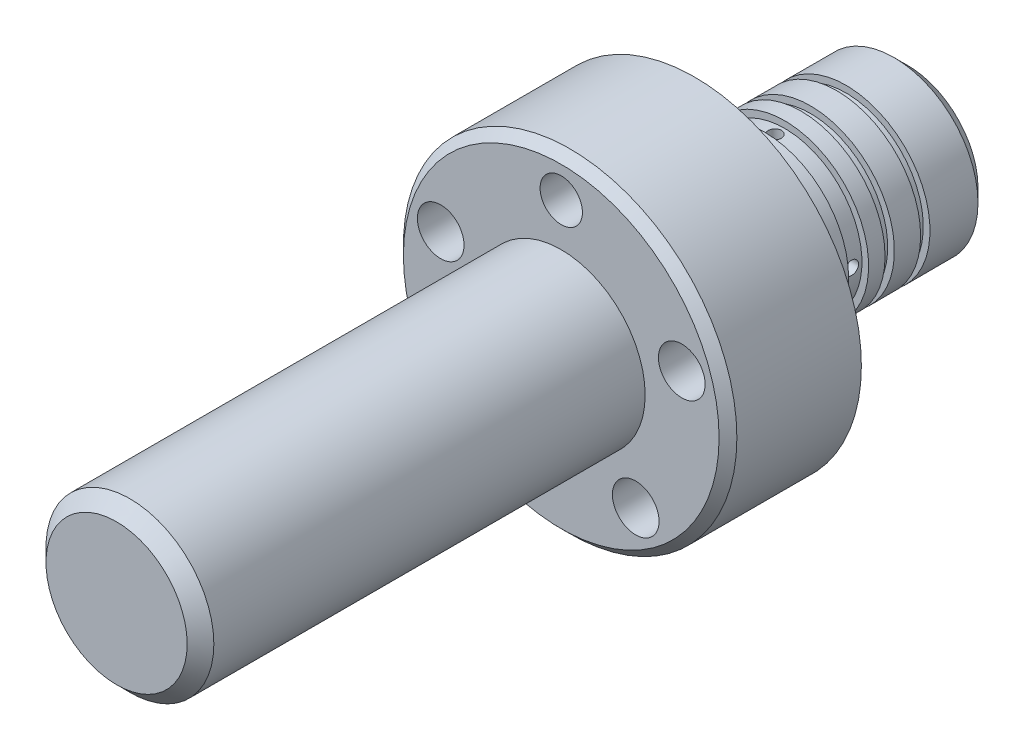
from build123d import *

# Parameters (mm, degrees)
SKETCH1_R                 = 18.875
BOSS_EXTRUDE1_DEPTH       = 47.85
SKETCH2_R                 = 37.5
BOSS_EXTRUDE2_DEPTH       = 30
SKETCH11_R                = 3.125
CUT_EXTRUDE4_DEPTH        = 30
SKETCH12_R                = 4.7625
CUT_EXTRUDE5_DEPTH        = 8
SKETCH13_W                = 2.1
SKETCH13_H                = 3
SKETCH13_W_2              = 4.5
SKETCH13_H_2              = 2.2
SKETCH18_R                = 3.125
CUT_EXTRUDE8_DEPTH        = 30
SKETCH19_R                = 5.25
CUT_EXTRUDE9_DEPTH        = 27
CHAMFER1_SIZE             = 2
SKETCH20_R                = 18.875
BOSS_EXTRUDE3_DEPTH       = 100
F_8_0MM_DOWEL_HOLE1_D     = 8
F_8_0MM_DOWEL_HOLE1_DEPTH = 77.85
F_8_0MM_DOWEL_HOLE1_TIP   = 2.403442476
CHAMFER2_SIZE             = 3
SKETCH26_R                = 1.5
CUT_EXTRUDE10_DEPTH       = 186.58858401
CIRPATTERN1_COUNT         = 4


with BuildPart() as part:
    # Sketch1 → Boss-Extrude1 (new body)
    with BuildSketch(Plane.XY):
        Circle(SKETCH1_R)
    extrude(amount=BOSS_EXTRUDE1_DEPTH)

    # Sketch2 → Boss-Extrude2 (add)
    with BuildSketch(Plane.XY.offset(47.85)):
        Circle(SKETCH2_R)
    extrude(amount=BOSS_EXTRUDE2_DEPTH)

    # Sketch11 → Cut-Extrude4 (cut)
    with BuildSketch(Plane.XY.offset(77.85)):
        with Locations((0, 28.5)):
            Circle(SKETCH11_R)
    extrude(amount=-CUT_EXTRUDE4_DEPTH, mode=Mode.SUBTRACT)

    # Sketch12 → Cut-Extrude5 (cut)
    with BuildSketch(Plane.XY.offset(77.85)):
        with Locations((0, 28.5)):
            Circle(SKETCH12_R)
    extrude(amount=-CUT_EXTRUDE5_DEPTH, mode=Mode.SUBTRACT)

    # Sketch13 → Cut-Revolve1 (revolve, cut)
    with BuildSketch(Plane(origin=(0, 0, 0), x_dir=(0, 0, -1), z_dir=(1, 0, 0)), mode=Mode.PRIVATE) as cut_revolve1_sk:
        with Locations((-14.85, 18.875)):
            Rectangle(SKETCH13_W, SKETCH13_H)
        with Locations((-22.85, 18.875)):
            Rectangle(SKETCH13_W, SKETCH13_H)
        with Locations((-35.85, 18.875)):
            Rectangle(SKETCH13_W, SKETCH13_H)
        with Locations((-39.85, 18.875)):
            Rectangle(SKETCH13_W, SKETCH13_H)
        with Locations((-29.85, 18.475)):
            Rectangle(SKETCH13_W_2, SKETCH13_H_2)
    revolve(cut_revolve1_sk.sketch.rotate(Axis((0, 0, 0), (0, 0, 1)), 90), axis=Axis((0, 0, 0), (0, 0, 1)), mode=Mode.SUBTRACT)

    # Sketch18 → Cut-Extrude8 (cut)
    with BuildSketch(Plane.XY.offset(77.85)):
        with Locations((27.105110714, 8.80698434)):
            Circle(SKETCH18_R)
        with Locations((16.75187969, -23.05698434)):
            Circle(SKETCH18_R)
        with Locations((-16.75187969, -23.05698434)):
            Circle(SKETCH18_R)
        with Locations((-27.105110714, 8.80698434)):
            Circle(SKETCH18_R)
    extrude(amount=-CUT_EXTRUDE8_DEPTH, mode=Mode.SUBTRACT)

    # Sketch19 → Cut-Extrude9 (cut)
    with BuildSketch(Plane.XY.offset(77.85)):
        with Locations((27.105110714, 8.80698434)):
            Circle(SKETCH19_R)
        with Locations((16.75187969, -23.05698434)):
            Circle(SKETCH19_R)
        with Locations((-16.75187969, -23.05698434)):
            Circle(SKETCH19_R)
        with Locations((-27.105110714, 8.80698434)):
            Circle(SKETCH19_R)
    extrude(amount=-CUT_EXTRUDE9_DEPTH, mode=Mode.SUBTRACT)

    # Chamfer1
    chamfer1_edges = [part.edges().sort_by_distance(p)[0] for p in [
        (-37.5, 0, 77.85),
    ]]
    chamfer(chamfer1_edges, length=CHAMFER1_SIZE)

    # Sketch20 → Boss-Extrude3 (add)
    with BuildSketch(Plane.XY.offset(77.85)):
        with Locations(Location((0, 0, 0), (0, 0, 180))):
            Circle(SKETCH20_R)
    extrude(amount=BOSS_EXTRUDE3_DEPTH)

    # Ø8.0mm Dowel Hole1
    with Locations(Plane(origin=(0, 0, 0), x_dir=(-1, 0, 0), z_dir=(0, 0, -1))):
        with Locations((0, 0)):
            Hole(F_8_0MM_DOWEL_HOLE1_D / 2, depth=F_8_0MM_DOWEL_HOLE1_DEPTH)
            with Locations((0, 0, -(F_8_0MM_DOWEL_HOLE1_DEPTH + F_8_0MM_DOWEL_HOLE1_TIP / 2))):  # 118° drill point
                Cone(0, F_8_0MM_DOWEL_HOLE1_D / 2, F_8_0MM_DOWEL_HOLE1_TIP, mode=Mode.SUBTRACT)

    # Sketch25 → Cut-Revolve2 (revolve, cut)
    with BuildSketch(Plane(origin=(0, 0, 0), x_dir=(0, 0, -1), z_dir=(1, 0, 0))):
        Polygon((-65.25, 0), (-65.25, -12.5), (-65.85, -12.5), (-65.85, -22.5), (-71.85, -22.5), (-71.85, -41.115481675), (-61.85, -41.115481675), (-61.85, 0), align=None)
    revolve(axis=Axis((0, 37.5, 61.85), (0, -1, 0)), mode=Mode.SUBTRACT)

    # Chamfer2
    chamfer2_edges = [part.edges().sort_by_distance(p)[0] for p in [
        (18.875, 0, 177.85),
        (-18.875, 0, 0),
    ]]
    chamfer(chamfer2_edges, length=CHAMFER2_SIZE)

    # Sketch26 → Cut-Extrude10 (cut, through all)
    with BuildSketch(Plane(origin=(0, 0, 0), x_dir=(1, 0, 0), z_dir=(0, 1, 0))):
        with Locations(Location((0, -29.85, 0), (0, 0, 270))):
            Circle(SKETCH26_R)
    cut_extrude10 = extrude(amount=-CUT_EXTRUDE10_DEPTH, mode=Mode.SUBTRACT)

    # CirPattern1: Cut-Extrude10 ×4 about axis
    cirpattern1_axis = Axis((0, 0, 27.6), (0, 0, -1))
    for i in range(1, CIRPATTERN1_COUNT):
        add(cut_extrude10.rotate(cirpattern1_axis, i * 360 / CIRPATTERN1_COUNT), mode=Mode.SUBTRACT)


solid = part.part
